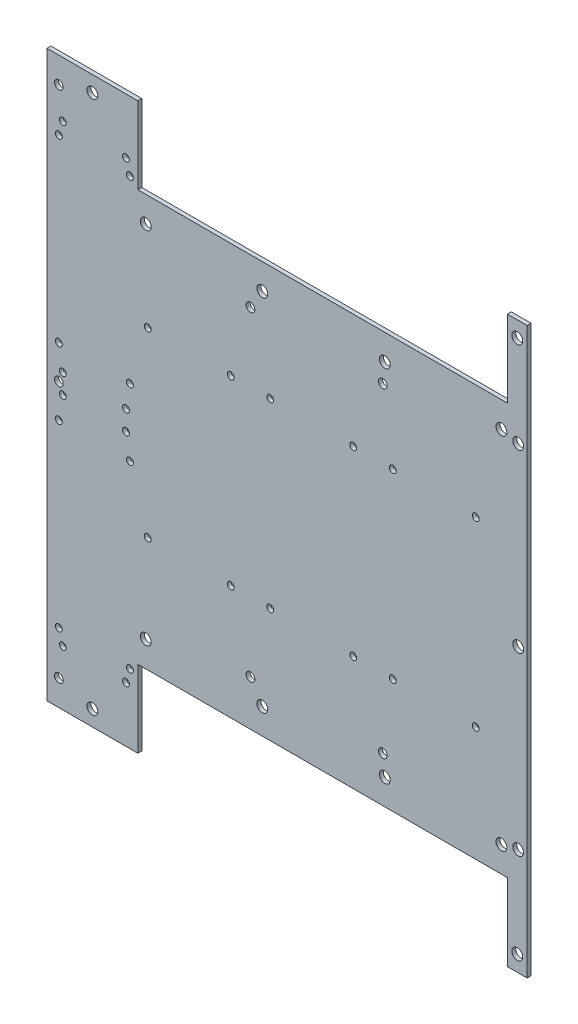
from build123d import *

# Parameters (mm, degrees)
MOTOR_AND_BATTERY_FLOOR_PROFILE_R   = 2.75
MOTOR_AND_BATTERY_FLOOR_PROFILE_R_2 = 1.75
MOTOR_AND_BATTERY_FLOOR_PROFILE_R_3 = 2.2
MOTOR_AND_BATTERY_FLOOR_DEPTH       = 2


with BuildPart() as part:
    # Motor and battery floor profile → Motor and battery floor (new body)
    with BuildSketch(Plane.XY):
        Polygon((-140, -143), (-94, -143), (-94, -104), (93, -104), (93, -143), (103, -143), (103, 143), (93, 143), (93, 104), (-94, 104), (-94, 143), (-140, 143), align=None)
        with Locations((-90, -91)):
            Circle(MOTOR_AND_BATTERY_FLOOR_PROFILE_R, mode=Mode.SUBTRACT)
        with Locations((-90, 91)):
            Circle(MOTOR_AND_BATTERY_FLOOR_PROFILE_R, mode=Mode.SUBTRACT)
        with Locations((-31, -91)):
            Circle(MOTOR_AND_BATTERY_FLOOR_PROFILE_R, mode=Mode.SUBTRACT)
        with Locations((-31, 91)):
            Circle(MOTOR_AND_BATTERY_FLOOR_PROFILE_R, mode=Mode.SUBTRACT)
        with Locations((31, -91)):
            Circle(MOTOR_AND_BATTERY_FLOOR_PROFILE_R, mode=Mode.SUBTRACT)
        with Locations((31, 91)):
            Circle(MOTOR_AND_BATTERY_FLOOR_PROFILE_R, mode=Mode.SUBTRACT)
        with Locations((90, -91)):
            Circle(MOTOR_AND_BATTERY_FLOOR_PROFILE_R, mode=Mode.SUBTRACT)
        with Locations((90, 91)):
            Circle(MOTOR_AND_BATTERY_FLOOR_PROFILE_R, mode=Mode.SUBTRACT)
        with Locations((-134, -108)):
            Circle(MOTOR_AND_BATTERY_FLOOR_PROFILE_R_2, mode=Mode.SUBTRACT)
        with Locations((-134, -17)):
            Circle(MOTOR_AND_BATTERY_FLOOR_PROFILE_R_2, mode=Mode.SUBTRACT)
        with Locations((-134, 17)):
            Circle(MOTOR_AND_BATTERY_FLOOR_PROFILE_R_2, mode=Mode.SUBTRACT)
        with Locations((-134, 108)):
            Circle(MOTOR_AND_BATTERY_FLOOR_PROFILE_R_2, mode=Mode.SUBTRACT)
        with Locations((-98, -108)):
            Circle(MOTOR_AND_BATTERY_FLOOR_PROFILE_R_2, mode=Mode.SUBTRACT)
        with Locations((-98, -17)):
            Circle(MOTOR_AND_BATTERY_FLOOR_PROFILE_R_2, mode=Mode.SUBTRACT)
        with Locations((-98, 17)):
            Circle(MOTOR_AND_BATTERY_FLOOR_PROFILE_R_2, mode=Mode.SUBTRACT)
        with Locations((-98, 108)):
            Circle(MOTOR_AND_BATTERY_FLOOR_PROFILE_R_2, mode=Mode.SUBTRACT)
        with Locations((-89, -46)):
            Circle(MOTOR_AND_BATTERY_FLOOR_PROFILE_R_2, mode=Mode.SUBTRACT)
        with Locations((-89, 46)):
            Circle(MOTOR_AND_BATTERY_FLOOR_PROFILE_R_2, mode=Mode.SUBTRACT)
        with Locations((-47, -46)):
            Circle(MOTOR_AND_BATTERY_FLOOR_PROFILE_R_2, mode=Mode.SUBTRACT)
        with Locations((-47, 46)):
            Circle(MOTOR_AND_BATTERY_FLOOR_PROFILE_R_2, mode=Mode.SUBTRACT)
        with Locations((-27, -46)):
            Circle(MOTOR_AND_BATTERY_FLOOR_PROFILE_R_2, mode=Mode.SUBTRACT)
        with Locations((-27, 46)):
            Circle(MOTOR_AND_BATTERY_FLOOR_PROFILE_R_2, mode=Mode.SUBTRACT)
        with Locations((15, -46)):
            Circle(MOTOR_AND_BATTERY_FLOOR_PROFILE_R_2, mode=Mode.SUBTRACT)
        with Locations((15, 46)):
            Circle(MOTOR_AND_BATTERY_FLOOR_PROFILE_R_2, mode=Mode.SUBTRACT)
        with Locations((35, -46)):
            Circle(MOTOR_AND_BATTERY_FLOOR_PROFILE_R_2, mode=Mode.SUBTRACT)
        with Locations((35, 46)):
            Circle(MOTOR_AND_BATTERY_FLOOR_PROFILE_R_2, mode=Mode.SUBTRACT)
        with Locations((77, -46)):
            Circle(MOTOR_AND_BATTERY_FLOOR_PROFILE_R_2, mode=Mode.SUBTRACT)
        with Locations((77, 46)):
            Circle(MOTOR_AND_BATTERY_FLOOR_PROFILE_R_2, mode=Mode.SUBTRACT)
        with Locations((-117, -135)):
            Circle(MOTOR_AND_BATTERY_FLOOR_PROFILE_R, mode=Mode.SUBTRACT)
        with Locations((-117, 135)):
            Circle(MOTOR_AND_BATTERY_FLOOR_PROFILE_R, mode=Mode.SUBTRACT)
        with Locations((98, -135)):
            Circle(MOTOR_AND_BATTERY_FLOOR_PROFILE_R, mode=Mode.SUBTRACT)
        with Locations((98, 135)):
            Circle(MOTOR_AND_BATTERY_FLOOR_PROFILE_R, mode=Mode.SUBTRACT)
        with Locations((98.5, -89)):
            Circle(MOTOR_AND_BATTERY_FLOOR_PROFILE_R, mode=Mode.SUBTRACT)
        with Locations((98.5, 0)):
            Circle(MOTOR_AND_BATTERY_FLOOR_PROFILE_R, mode=Mode.SUBTRACT)
        with Locations((98.5, 89)):
            Circle(MOTOR_AND_BATTERY_FLOOR_PROFILE_R, mode=Mode.SUBTRACT)
        with Locations((-134, -130)):
            Circle(MOTOR_AND_BATTERY_FLOOR_PROFILE_R_3, mode=Mode.SUBTRACT)
        with Locations((-134, 0)):
            Circle(MOTOR_AND_BATTERY_FLOOR_PROFILE_R_3, mode=Mode.SUBTRACT)
        with Locations((-134, 130)):
            Circle(MOTOR_AND_BATTERY_FLOOR_PROFILE_R_3, mode=Mode.SUBTRACT)
        with Locations((-37, -81)):
            Circle(MOTOR_AND_BATTERY_FLOOR_PROFILE_R_3, mode=Mode.SUBTRACT)
        with Locations((-37, 81)):
            Circle(MOTOR_AND_BATTERY_FLOOR_PROFILE_R_3, mode=Mode.SUBTRACT)
        with Locations((30, -81)):
            Circle(MOTOR_AND_BATTERY_FLOOR_PROFILE_R_3, mode=Mode.SUBTRACT)
        with Locations((30, 81)):
            Circle(MOTOR_AND_BATTERY_FLOOR_PROFILE_R_3, mode=Mode.SUBTRACT)
        with Locations((-132, -115)):
            Circle(MOTOR_AND_BATTERY_FLOOR_PROFILE_R_2, mode=Mode.SUBTRACT)
        with Locations((-132, -5)):
            Circle(MOTOR_AND_BATTERY_FLOOR_PROFILE_R_2, mode=Mode.SUBTRACT)
        with Locations((-132, 5)):
            Circle(MOTOR_AND_BATTERY_FLOOR_PROFILE_R_2, mode=Mode.SUBTRACT)
        with Locations((-132, 115)):
            Circle(MOTOR_AND_BATTERY_FLOOR_PROFILE_R_2, mode=Mode.SUBTRACT)
        with Locations((-100, -115)):
            Circle(MOTOR_AND_BATTERY_FLOOR_PROFILE_R_2, mode=Mode.SUBTRACT)
        with Locations((-100, -5)):
            Circle(MOTOR_AND_BATTERY_FLOOR_PROFILE_R_2, mode=Mode.SUBTRACT)
        with Locations((-100, 5)):
            Circle(MOTOR_AND_BATTERY_FLOOR_PROFILE_R_2, mode=Mode.SUBTRACT)
        with Locations((-100, 115)):
            Circle(MOTOR_AND_BATTERY_FLOOR_PROFILE_R_2, mode=Mode.SUBTRACT)
    extrude(amount=MOTOR_AND_BATTERY_FLOOR_DEPTH)


solid = part.part
